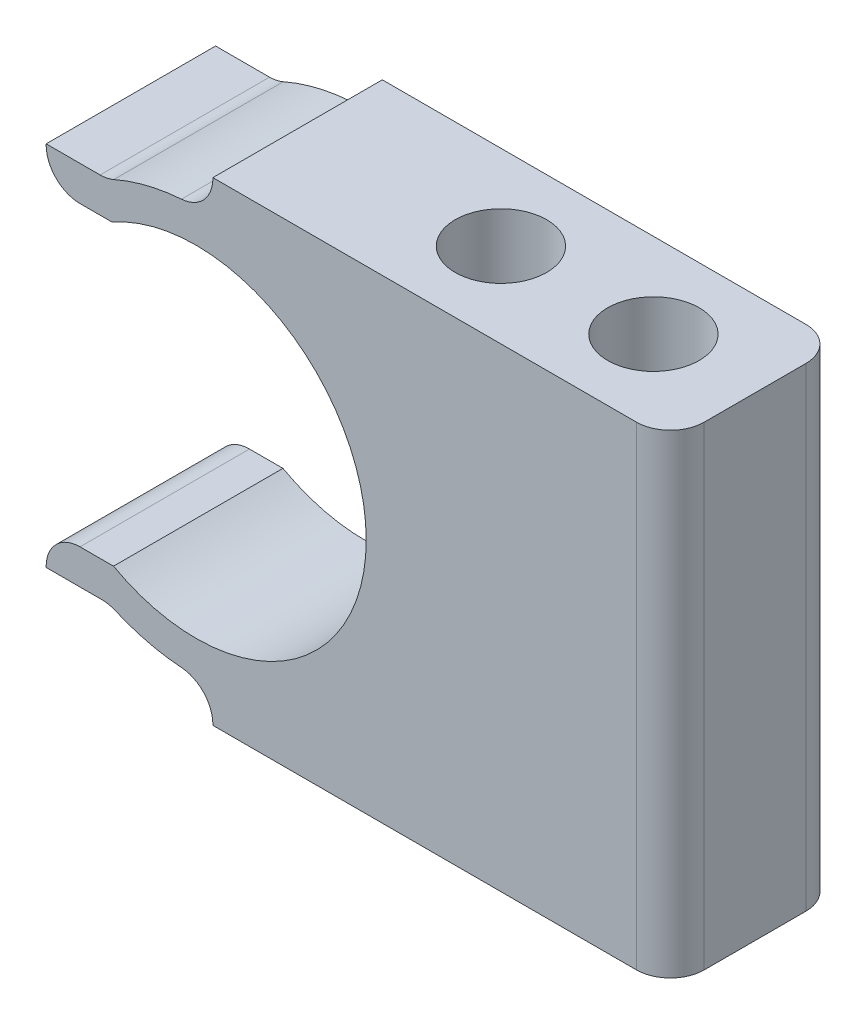
from build123d import *

# Parameters (mm, degrees)
BOSS_EXTRUDE1_DEPTH = 10
FILLET1_R           = 2
SKETCH2_R           = 2.7
CUT_EXTRUDE1_DEPTH  = 41.841155713


with BuildPart() as part:
    # Sketch1 → Boss-Extrude1 (new body)
    with BuildSketch(Plane.XY):
        with BuildLine():
            Line((1, -11.958260743), (1, -14))
            Line((1, -14), (10, -14))
            Line((10, -14), (28, -14))
            Line((28, -14), (28, 14))
            Line((28, 14), (6, 14))
            Line((6, 14), (1, 14))
            Line((1, 14), (1, 11.958260743))
            ThreePointArc((1, 11.958260743), (-2.185898684, 11.799230778), (-5.217338717, 10.806450699))
            Line((-5.217338717, 10.806450699), (-8.841229183, 10.806450699))
            Line((-8.841229183, 10.806450699), (-8.841229183, 8.75))
            Line((-8.841229183, 8.75), (-4.943682838, 8.75))
            ThreePointArc((-4.943682838, 8.75), (10.04990004, 0.04482392), (-4.865435329, -8.79375))
            Line((-4.865435329, -8.79375), (-8.841229183, -8.79375))
            Line((-8.841229183, -8.79375), (-8.841229183, -10.849241119))
            Line((-8.841229183, -10.849241119), (-5.127764341, -10.849241119))
            ThreePointArc((-5.127764341, -10.849241119), (-2.137075278, -11.808171292), (1, -11.958260743))
        make_face()
    extrude(amount=BOSS_EXTRUDE1_DEPTH)

    # Fillet1
    fillet1_edges = [part.edges().sort_by_distance(p)[0] for p in [
        (28, 0, 0),
        (-8.841229183, 8.75, 5),
        (-5.217338717, 10.806450699, 5),
        (1, 11.958260743, 5),
        (1, -11.958260743, 5),
        (-5.127764341, -10.849241119, 5),
        (-8.841229183, -8.79375, 5),
        (28, 0, 10),
    ]]
    fillet(fillet1_edges, radius=FILLET1_R)

    # Sketch2 → Cut-Extrude1 (cut, through all)
    with BuildSketch(Plane.XZ.offset(14)):
        with Locations(Location((13, 5, 0), (0, 0, 270))):
            Circle(SKETCH2_R)
        with Locations(Location((22, 5, 0), (0, 0, 270))):
            Circle(SKETCH2_R)
    extrude(amount=-CUT_EXTRUDE1_DEPTH, mode=Mode.SUBTRACT)


solid = part.part
